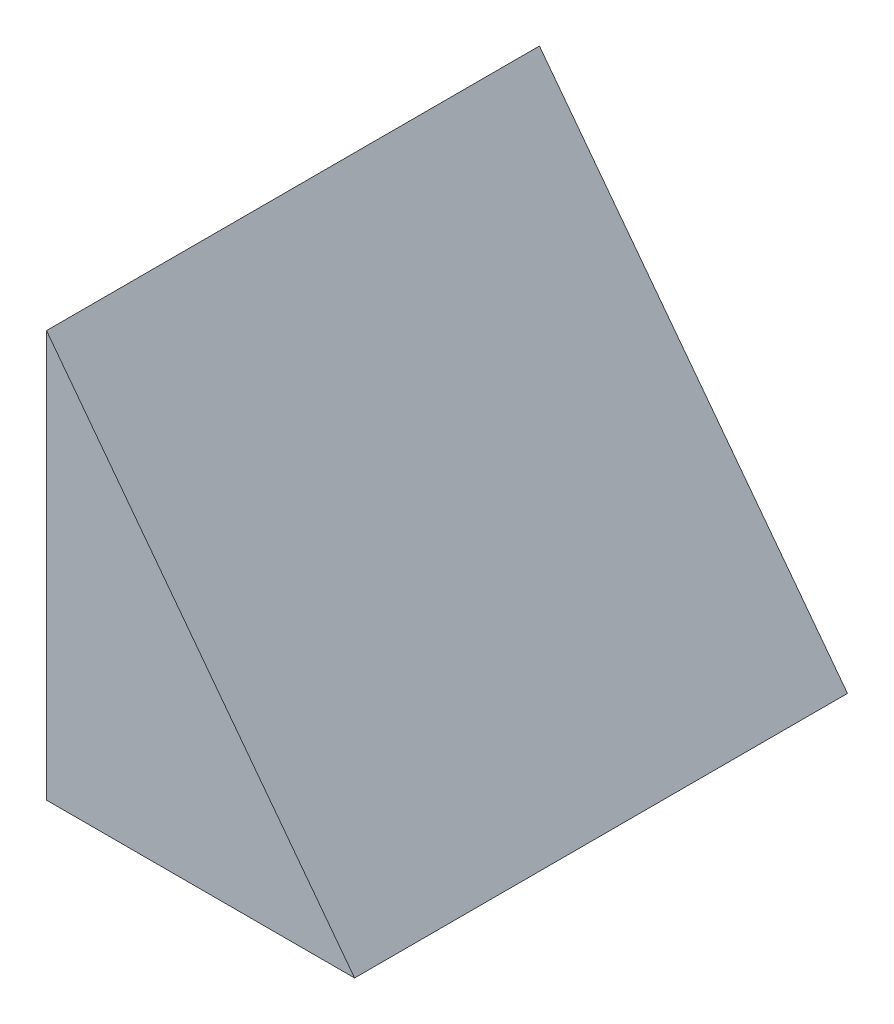
from build123d import *

# Parameters (mm, degrees)
BOSS_EXTRUDE1_DEPTH = 1016


with BuildPart() as part:
    # Sketch1 → Boss-Extrude1 (new body)
    with BuildSketch(Plane.XY):
        Polygon((0, 0), (0, 838.2), (635, 0), align=None)
    extrude(amount=-BOSS_EXTRUDE1_DEPTH)


solid = part.part
